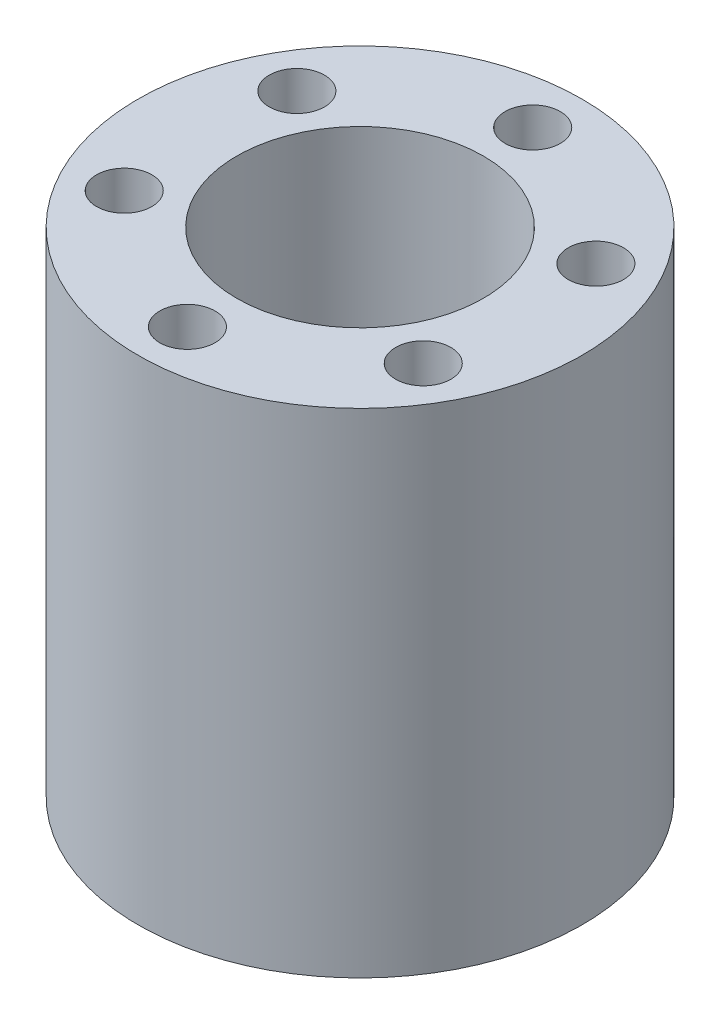
from build123d import *

# Parameters (mm, degrees)
SKETCH2_W                           = 10
SKETCH2_H                           = 25
F_5_6_5_6_DIAMETER_HOLE1_AT_2_COUNT = 2
F_5_6_5_6_DIAMETER_HOLE1_AT_2_PITCH = 17.5
F_5_6_5_6_DIAMETER_HOLE1_AT_3_COUNT = 2
F_5_6_5_6_DIAMETER_HOLE1_AT_3_PITCH = 30.310889132
F_5_6_5_6_DIAMETER_HOLE1_AT_4_COUNT = 2
F_5_6_5_6_DIAMETER_HOLE1_AT_4_PITCH = 35
F_5_6_5_6_DIAMETER_HOLE1_AT_5_COUNT = 2
F_5_6_5_6_DIAMETER_HOLE1_AT_5_PITCH = 30.310889132
F_5_6_5_6_DIAMETER_HOLE1_AT_6_COUNT = 2
F_5_6_5_6_DIAMETER_HOLE1_AT_6_PITCH = 17.5


with BuildPart() as part:
    # Sketch2 → Revolve1 (revolve)
    with BuildSketch(Plane.XY, mode=Mode.PRIVATE) as revolve1_sk:
        with Locations((17.5, 12.5)):
            Rectangle(SKETCH2_W, SKETCH2_H)
    revolve1 = revolve(revolve1_sk.sketch.rotate(Axis((0, 0, 0), (0, 1, 0)), 90), axis=Axis((0, 0, 0), (0, 1, 0)))

    # Sketch5 → Ø5.6 (5.6) Diameter Hole1 (revolve, cut)
    with BuildSketch(Plane(origin=(15.155444566, 25, 8.75), x_dir=(0, 0, 1), z_dir=(1, 0, 0))):
        Polygon((0, 0), (0, 9.682409733), (2.8, 8), (2.8, 0), align=None)
    f_5_6_5_6_diameter_hole1 = revolve(axis=Axis((15.155444566, 31.35, 8.75), (0, -1, 0)), mode=Mode.SUBTRACT)

    # Ø5.6 (5.6) Diameter Hole1 at 2: Ø5.6 (5.6) Diameter Hole1 ×2
    with Locations(*[Vector(-0.8660254037844417, 0, 0.49999999999999495) * (i * F_5_6_5_6_DIAMETER_HOLE1_AT_2_PITCH) for i in range(1, F_5_6_5_6_DIAMETER_HOLE1_AT_2_COUNT)]):
        add(f_5_6_5_6_diameter_hole1, mode=Mode.SUBTRACT)

    # Ø5.6 (5.6) Diameter Hole1 at 3: Ø5.6 (5.6) Diameter Hole1 ×2
    with Locations(*[(-i * F_5_6_5_6_DIAMETER_HOLE1_AT_3_PITCH, 0, 0) for i in range(1, F_5_6_5_6_DIAMETER_HOLE1_AT_3_COUNT)]):
        add(f_5_6_5_6_diameter_hole1, mode=Mode.SUBTRACT)

    # Ø5.6 (5.6) Diameter Hole1 at 4: Ø5.6 (5.6) Diameter Hole1 ×2
    with Locations(*[Vector(-0.8660254037844346, 0, -0.5000000000000072) * (i * F_5_6_5_6_DIAMETER_HOLE1_AT_4_PITCH) for i in range(1, F_5_6_5_6_DIAMETER_HOLE1_AT_4_COUNT)]):
        add(f_5_6_5_6_diameter_hole1, mode=Mode.SUBTRACT)

    # Ø5.6 (5.6) Diameter Hole1 at 5: Ø5.6 (5.6) Diameter Hole1 ×2
    with Locations(*[Vector(-0.49999999999999195, 0, -0.8660254037844433) * (i * F_5_6_5_6_DIAMETER_HOLE1_AT_5_PITCH) for i in range(1, F_5_6_5_6_DIAMETER_HOLE1_AT_5_COUNT)]):
        add(f_5_6_5_6_diameter_hole1, mode=Mode.SUBTRACT)

    # Ø5.6 (5.6) Diameter Hole1 at 6: Ø5.6 (5.6) Diameter Hole1 ×2
    with Locations(*[(0, 0, -i * F_5_6_5_6_DIAMETER_HOLE1_AT_6_PITCH) for i in range(1, F_5_6_5_6_DIAMETER_HOLE1_AT_6_COUNT)]):
        add(f_5_6_5_6_diameter_hole1, mode=Mode.SUBTRACT)

    # Mirror1: Revolve1, Ø5.6 (5.6) Diameter Hole1 across plane
    add(revolve1.mirror(Plane.ZX))
    add(f_5_6_5_6_diameter_hole1.mirror(Plane.ZX), mode=Mode.SUBTRACT)

    # Mirror1 copy 1 sketch → Mirror1 copy 1 (revolve, cut)
    with BuildSketch(Plane(origin=(0, -25, 17.5), x_dir=(0, 0, 1), z_dir=(1, 0, 0))):
        Polygon((0, 0), (0, -9.682409733), (2.8, -8), (2.8, 0), align=None)
    revolve(axis=Axis((0, -31.35, 17.5), (0, -1, 0)), mode=Mode.SUBTRACT)

    # Mirror1 copy 2 sketch → Mirror1 copy 2 (revolve, cut)
    with BuildSketch(Plane(origin=(-15.155444566, -25, 8.75), x_dir=(0, 0, 1), z_dir=(1, 0, 0))):
        Polygon((0, 0), (0, -9.682409733), (2.8, -8), (2.8, 0), align=None)
    revolve(axis=Axis((-15.155444566, -31.35, 8.75), (0, -1, 0)), mode=Mode.SUBTRACT)

    # Mirror1 copy 3 sketch → Mirror1 copy 3 (revolve, cut)
    with BuildSketch(Plane(origin=(-15.155444566, -25, -8.75), x_dir=(0, 0, 1), z_dir=(1, 0, 0))):
        Polygon((0, 0), (0, -9.682409733), (2.8, -8), (2.8, 0), align=None)
    revolve(axis=Axis((-15.155444566, -31.35, -8.75), (0, -1, 0)), mode=Mode.SUBTRACT)

    # Mirror1 copy 4 sketch → Mirror1 copy 4 (revolve, cut)
    with BuildSketch(Plane(origin=(0, -25, -17.5), x_dir=(0, 0, 1), z_dir=(1, 0, 0))):
        Polygon((0, 0), (0, -9.682409733), (2.8, -8), (2.8, 0), align=None)
    revolve(axis=Axis((0, -31.35, -17.5), (0, -1, 0)), mode=Mode.SUBTRACT)

    # Mirror1 copy 5 sketch → Mirror1 copy 5 (revolve, cut)
    with BuildSketch(Plane(origin=(15.155444566, -25, -8.75), x_dir=(0, 0, 1), z_dir=(1, 0, 0))):
        Polygon((0, 0), (0, -9.682409733), (2.8, -8), (2.8, 0), align=None)
    revolve(axis=Axis((15.155444566, -31.35, -8.75), (0, -1, 0)), mode=Mode.SUBTRACT)


solid = part.part
